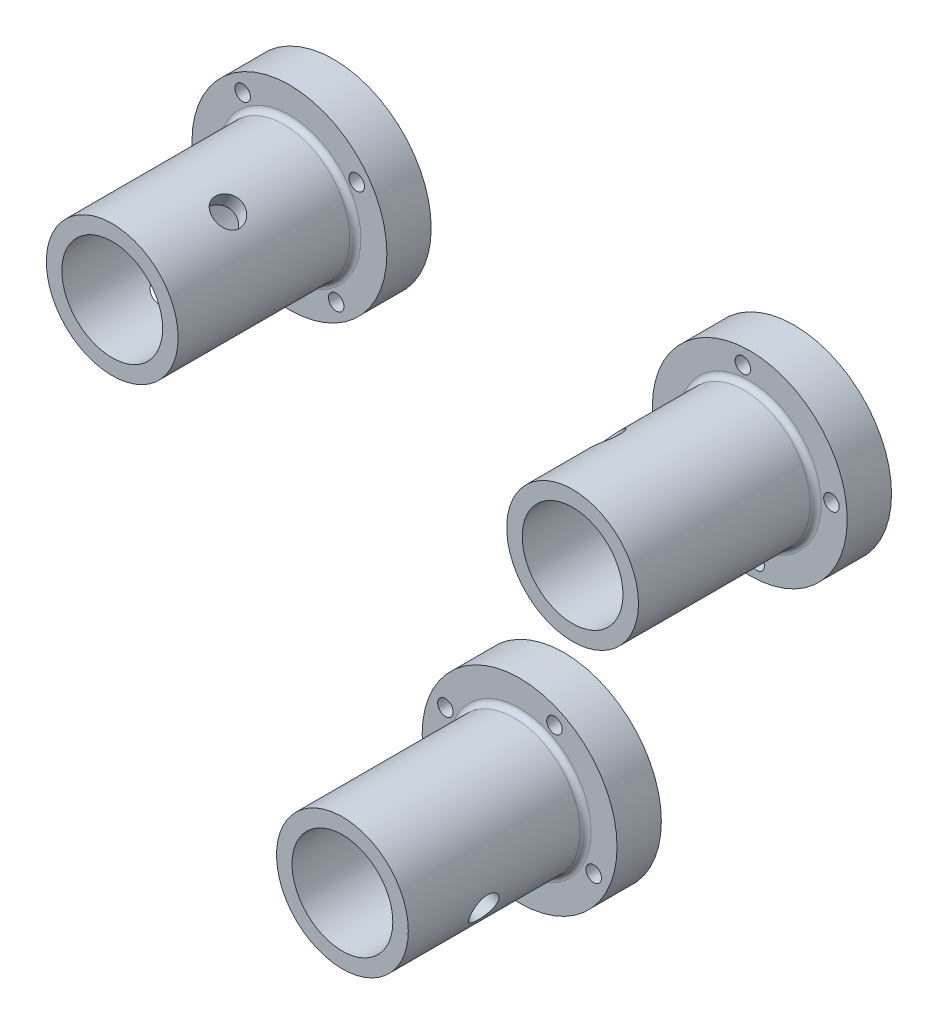
from build123d import *

# Parameters (mm, degrees)
SKETCH1_R               = 22
SKETCH1_R_2             = 1.75
SKETCH1_R_3             = 14.625
BOSS_EXTRUDE1_DEPTH     = 10
BOSS_EXTRUDE1_2_DEPTH   = 10
BOSS_EXTRUDE1_3_DEPTH   = 10
SKETCH2_R               = 14.875
SKETCH2_R_2             = 11.375
BOSS_EXTRUDE2_DEPTH     = 50
FILLET1_R               = 1.25
FILLET2_R               = 1.25
FILLET3_R               = 1.25
SKETCH4_R               = 3.25
CUT_EXTRUDE1_DEPTH      = 176.581139074
CUT_EXTRUDE2_DEPTH      = 180.079644729
CUT_EXTRUDE2_DEPTH_BACK = 180.079644729
SKETCH8_R               = 3.25
SKETCH10_R              = 3.25
CUT_EXTRUDE3_DEPTH      = 155.780979287


with BuildPart() as part:
    # Sketch1 → Boss-Extrude1 (new body)
    with BuildSketch(Plane.XY):
        with Locations((-407.846346301, -172.585944494)):
            Circle(SKETCH1_R)
        with Locations((-426.281095964, -174.138363522)):
            Circle(SKETCH1_R_2, mode=Mode.SUBTRACT)
        with Locations((-406.293927273, -191.020694157)):
            Circle(SKETCH1_R_2, mode=Mode.SUBTRACT)
        with Locations((-407.846346301, -172.585944494)):
            Circle(SKETCH1_R_3, mode=Mode.SUBTRACT)
        with Locations((-409.398765329, -154.15119483)):
            Circle(SKETCH1_R_2, mode=Mode.SUBTRACT)
        with Locations((-389.411596637, -171.033525465)):
            Circle(SKETCH1_R_2, mode=Mode.SUBTRACT)
    extrude(amount=BOSS_EXTRUDE1_DEPTH)



with BuildPart() as body_2:
    # Sketch1 → Boss-Extrude1 2 (new body)
    with BuildSketch(Plane.XY):
        with Locations((-459.807870528, -262.585944494)):
            Circle(SKETCH1_R)
        with Locations((-467.680811044, -279.327115529)):
            Circle(SKETCH1_R_2, mode=Mode.SUBTRACT)
        with Locations((-476.549041563, -254.713003978)):
            Circle(SKETCH1_R_2, mode=Mode.SUBTRACT)
        with Locations((-459.807870528, -262.585944494)):
            Circle(SKETCH1_R_3, mode=Mode.SUBTRACT)
        with Locations((-443.066699493, -270.45888501)):
            Circle(SKETCH1_R_2, mode=Mode.SUBTRACT)
        with Locations((-451.934930012, -245.844773458)):
            Circle(SKETCH1_R_2, mode=Mode.SUBTRACT)
    extrude(amount=BOSS_EXTRUDE1_2_DEPTH)


with BuildPart() as body_3:
    # Sketch1 → Boss-Extrude1 3 (new body)
    with BuildSketch(Plane.XY):
        with Locations((-511.769394755, -172.585944494)):
            Circle(SKETCH1_R)
        with Locations((-526.958146762, -183.147753641)):
            Circle(SKETCH1_R_2, mode=Mode.SUBTRACT)
        with Locations((-501.207585607, -187.774696501)):
            Circle(SKETCH1_R_2, mode=Mode.SUBTRACT)
        with Locations((-522.331203903, -157.397192487)):
            Circle(SKETCH1_R_2, mode=Mode.SUBTRACT)
        with Locations((-511.769394755, -172.585944494)):
            Circle(SKETCH1_R_3, mode=Mode.SUBTRACT)
        with Locations((-496.580642748, -162.024135346)):
            Circle(SKETCH1_R_2, mode=Mode.SUBTRACT)
    extrude(amount=BOSS_EXTRUDE1_3_DEPTH)


with BuildPart() as part_1:
    add(part.part)

    add(body_2.part)  # Boss-Extrude2 merges body 2

    add(body_3.part)  # Boss-Extrude2 merges body 3
    # Sketch2 → Boss-Extrude2 (add)
    # profile 1 of 3: a face of its own
    with BuildSketch(Plane.XY):
        with Locations((-511.769394755, -172.585944494)):
            Circle(SKETCH2_R)
        with Locations((-511.769394755, -172.585944494)):
            Circle(SKETCH2_R_2, mode=Mode.SUBTRACT)
    # profile 2 of 3: a face of its own
    with BuildSketch(Plane.XY):
        with Locations((-407.846346301, -172.585944494)):
            Circle(SKETCH2_R)
        with Locations((-407.846346301, -172.585944494)):
            Circle(SKETCH2_R_2, mode=Mode.SUBTRACT)
    # profile 3 of 3: a face of its own
    with BuildSketch(Plane.XY):
        with Locations((-459.807870528, -262.585944494)):
            Circle(SKETCH2_R)
        with Locations((-459.807870528, -262.585944494)):
            Circle(SKETCH2_R_2, mode=Mode.SUBTRACT)
    extrude(amount=BOSS_EXTRUDE2_DEPTH)

    # Fillet1
    fillet1_edges = [part_1.edges().sort_by_distance(p)[0] for p in [
        (-526.644394755, -172.585944494, 10),
    ]]
    fillet(fillet1_edges, radius=FILLET1_R)

    # Fillet2
    fillet2_edges = [part_1.edges().sort_by_distance(p)[0] for p in [
        (-474.682870528, -262.585944494, 10),
    ]]
    fillet(fillet2_edges, radius=FILLET2_R)

    # Fillet3
    fillet3_edges = [part_1.edges().sort_by_distance(p)[0] for p in [
        (-422.721346301, -172.585944494, 10),
    ]]
    fillet(fillet3_edges, radius=FILLET3_R)

    # Sketch4 → Cut-Extrude1 (cut, through all)
    with BuildSketch(Plane(origin=(-398.627346212, -184.259661227, 50), x_dir=(-0.7847876795385339, -0.6197647118419406, 0), z_dir=(0.6197647118419406, -0.7847876795385339, 0))):
        with Locations((1.076682742, 18)):
            Circle(SKETCH4_R)
    extrude(amount=-CUT_EXTRUDE1_DEPTH, mode=Mode.SUBTRACT)

    # Sketch8 → Cut-Extrude2 (cut, two sides: drawn at the far end of the back side and taken through both)
    with BuildSketch(Plane(origin=(-504.162634811, -159.803032926, 50), x_dir=(0.8593553995270007, -0.5113788197645548, 0), z_dir=(0.5113788197645548, 0.8593553995270007, 0)).offset(-CUT_EXTRUDE2_DEPTH_BACK)):
        with Locations((0.702122631, 18)):
            Circle(SKETCH8_R)
    extrude(amount=CUT_EXTRUDE2_DEPTH + CUT_EXTRUDE2_DEPTH_BACK, mode=Mode.SUBTRACT)

    # Sketch10 → Cut-Extrude3 (cut, through all)
    with BuildSketch(Plane(origin=(-445.860931986, -267.757842629, 50), x_dir=(0, 0, -1), z_dir=(0.9376093137165733, -0.34769063092343505, 0))):
        with Locations((18, 0)):
            Circle(SKETCH10_R)
    extrude(amount=-CUT_EXTRUDE3_DEPTH, mode=Mode.SUBTRACT)


solid = part_1.part
